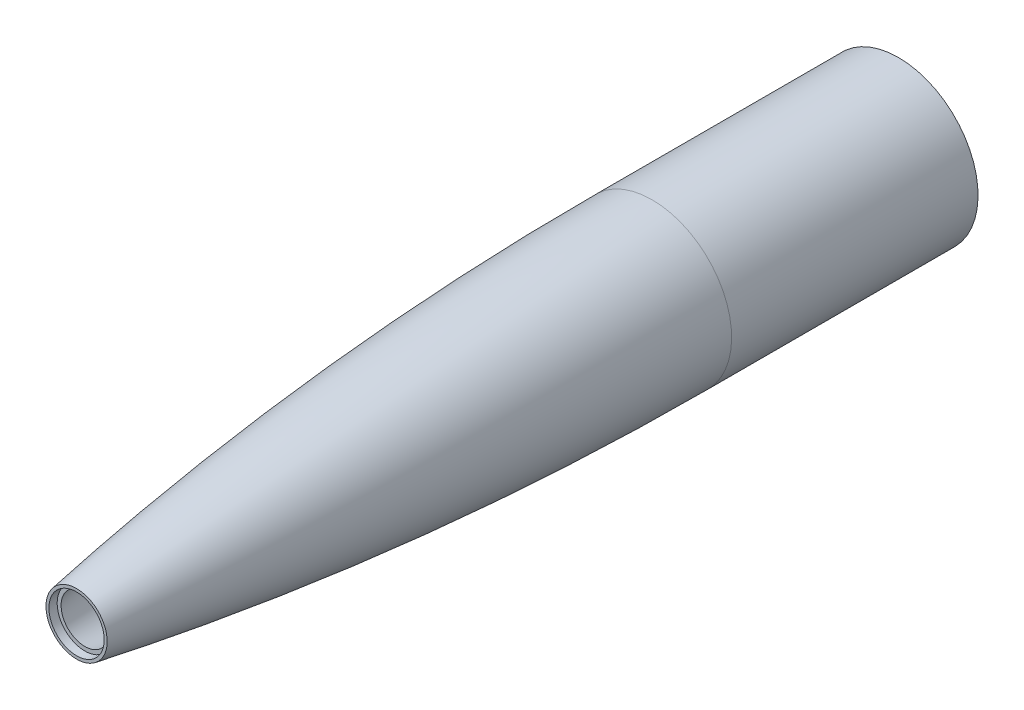
from build123d import *


with BuildPart() as part:
    # Sketch1 → Revolve1 (revolve)
    with BuildSketch(Plane(origin=(0, 0, 0), x_dir=(0, 0, -1), z_dir=(1, 0, 0))):
        with BuildLine():
            Line((0, 20.28), (-62.82, 20.28))
            ThreePointArc((-62.82, 20.28), (-136.449890839, 17.154377632), (-209.55, 7.8))
            Line((-209.55, 7.8), (-209.55, 7.05))
            Line((-209.55, 7.05), (-207.45, 7.05))
            Line((-207.45, 7.05), (-207.45, 6.05))
            ThreePointArc((-207.45, 6.05), (-135.436922614, 15.965609806), (-62.82, 19.28))
            Line((-62.82, 19.28), (0, 19.28))
            Line((0, 19.28), (0, 20.28))
        make_face()
    revolve(axis=Axis((0, 0, 0), (0, 0, 1)))


solid = part.part
